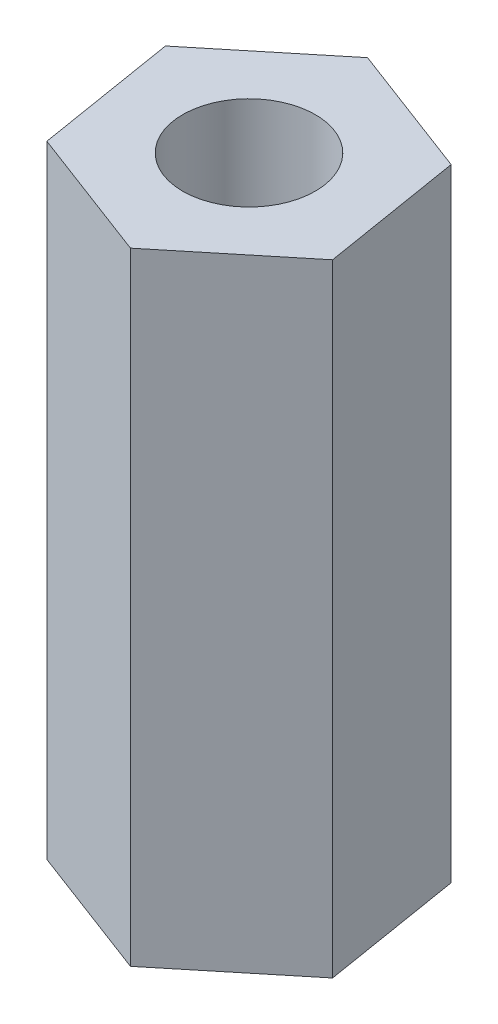
from build123d import *

# Parameters (mm, degrees)
SKETCH1_R           = 1.6
BOSS_EXTRUDE1_DEPTH = 15


with BuildPart() as part:
    # Sketch1 → Boss-Extrude1 (new body)
    with BuildSketch(Plane(origin=(0, 0, 0), x_dir=(1, 0, 0), z_dir=(0, 1, 0))):
        Polygon((0.55941281, -3.418633837), (3.240330154, -1.224851214), (2.680917344, 2.193782623), (-0.55941281, 3.418633837), (-3.240330154, 1.224851214), (-2.680917344, -2.193782623), align=None)
        with Locations(Location((0, 0, 0), (0, 0, 270))):
            Circle(SKETCH1_R, mode=Mode.SUBTRACT)
    extrude(amount=BOSS_EXTRUDE1_DEPTH)


solid = part.part
